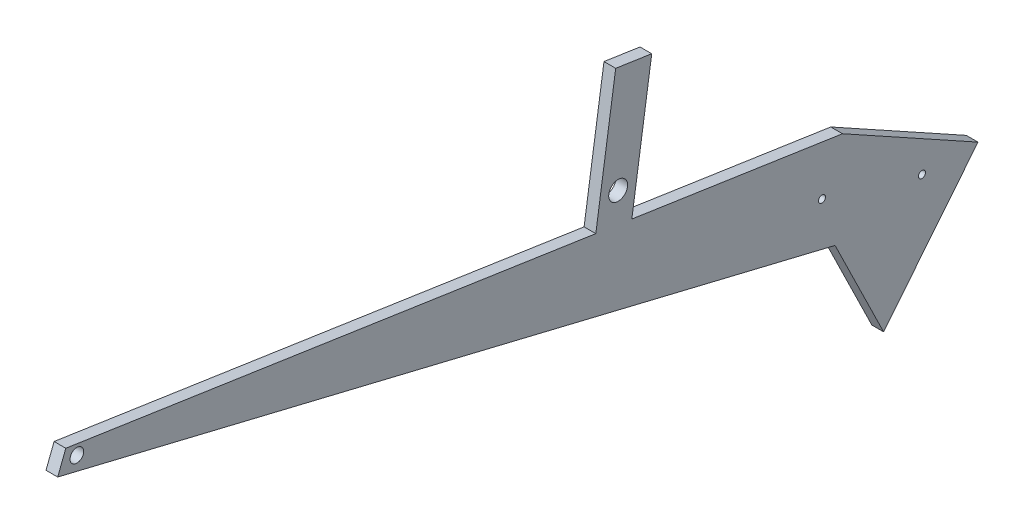
from build123d import *

# Parameters (mm, degrees)
SKETCH_1_R          = 0.6
SKETCH_1_R_2        = 1.16208208
EXTRUDE_1_DEPTH     = 2
SKETCH_2_W          = 2
SKETCH_2_H          = 6.221940724
EXTRUDE_2_DEPTH     = 22.998818
SKETCH_3_R          = 1.614508757
CUT_EXTRUDE_1_DEPTH = 136.634989839


with BuildPart() as part:
    # 草图1 → 凸台-拉伸1 (new body)
    with BuildSketch(Plane(origin=(0, 0, 0), x_dir=(0, 0, -1), z_dir=(1, 0, 0))):
        Polygon((-129.110885337, 27.705001714), (3.4977294, 7.905798819), (26.635169992, -4.901598114), (10.519539729, -24.901019931), (2.231501308, -7.979608155), (-130.492225074, 24.136540727), align=None)
        Circle(SKETCH_1_R, mode=Mode.SUBTRACT)
        with Locations((17.069222108, -4.901598114)):
            Circle(SKETCH_1_R, mode=Mode.SUBTRACT)
        with Locations((-127.222518318, 25.717836253)):
            Circle(SKETCH_1_R_2, mode=Mode.SUBTRACT)
    extrude(amount=EXTRUDE_1_DEPTH)

    # 草图2 → 凸台-拉伸2 (add)
    with BuildSketch(Plane(origin=(0, 8.244247262, -1.230911918), x_dir=(1, 0, 0), z_dir=(0, 0.9890368823707517, -0.14766870118729958))):
        with Locations((1, -37.181709338)):
            Rectangle(SKETCH_2_W, SKETCH_2_H)
    extrude(amount=EXTRUDE_2_DEPTH)

    # 草图3 → 切除-拉伸1 (cut, through all)
    with BuildSketch(Plane(origin=(2, 0, 0), x_dir=(0, 0, -1), z_dir=(1, 0, 0))):
        with Locations((-34.804826462, 18.6800064)):
            Circle(SKETCH_3_R)
    extrude(amount=-CUT_EXTRUDE_1_DEPTH, mode=Mode.SUBTRACT)


solid = part.part
